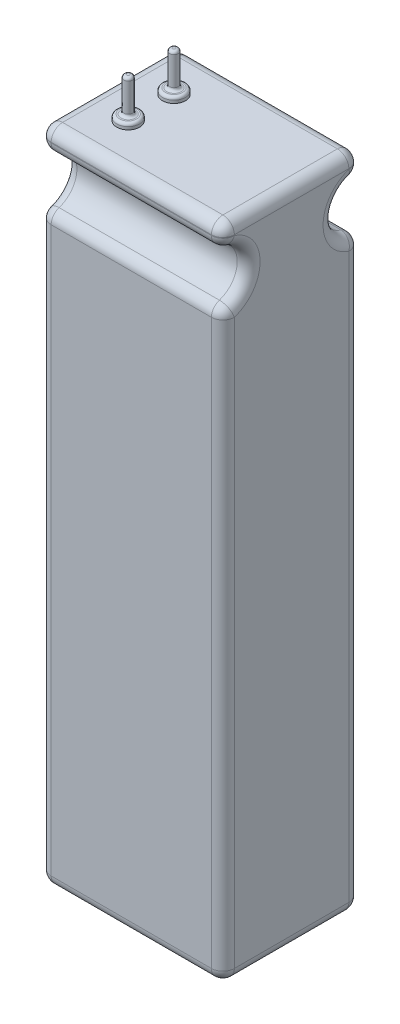
from build123d import *

# Parameters (mm, degrees)
SKETCH1_W           = 32
SKETCH1_H           = 24
BOSS_EXTRUDE1_DEPTH = 115
SKETCH2_R           = 4.5
CUT_EXTRUDE1_DEPTH  = 40
FILLET1_R           = 2
FILLET2_R           = 2
FILLET3_R           = 2
FILLET4_R           = 2
FILLET5_R           = 2
FILLET6_R           = 2
SKETCH3_R           = 2
BOSS_EXTRUDE2_DEPTH = 1
SKETCH4_R           = 0.75
BOSS_EXTRUDE3_DEPTH = 7
FILLET7_R           = 0.5
FILLET8_R           = 0.5


with BuildPart() as part:
    # Sketch1 → Boss-Extrude1 (new body)
    with BuildSketch(Plane(origin=(0, 0, 0), x_dir=(1, 0, 0), z_dir=(0, 1, 0))):
        Rectangle(SKETCH1_W, SKETCH1_H)
    extrude(amount=BOSS_EXTRUDE1_DEPTH)

    # Sketch2 → Cut-Extrude1 (cut)
    with BuildSketch(Plane.ZY.offset(16)):
        with Locations((12, 106.696833766)):
            Circle(SKETCH2_R)
        with Locations((-12, 106.696833766)):
            Circle(SKETCH2_R)
    extrude(amount=-CUT_EXTRUDE1_DEPTH, mode=Mode.SUBTRACT)

    # Fillet1
    fillet1_edges = [part.edges().sort_by_distance(p)[0] for p in [
        (0, 111.196833766, 12),
        (0, 102.196833766, 12),
    ]]
    fillet(fillet1_edges, radius=FILLET1_R)

    # Fillet2
    fillet2_edges = [part.edges().sort_by_distance(p)[0] for p in [
        (-16, 106.696833766, 7.5),
        (-16, 50.256087664, 12),
        (-16, 101.688872139, 11.61721508),
        (-16, 111.704795394, 11.61721508),
        (-16, 113.940746102, 12),
    ]]
    fillet(fillet2_edges, radius=FILLET2_R)

    # Fillet3
    fillet3_edges = [part.edges().sort_by_distance(p)[0] for p in [
        (-16, 51.098416883, -12),
        (-16, 106.696833766, -7.5),
        (0, 111.196833766, -12),
        (0, 102.196833766, -12),
        (-16, 113.098416883, -12),
    ]]
    fillet(fillet3_edges, radius=FILLET3_R)

    # Fillet4
    fillet4_edges = [part.edges().sort_by_distance(p)[0] for p in [
        (16, 106.696833766, 7.5),
        (16, 50.256087664, 12),
        (16, 101.688872139, 11.61721508),
        (16, 111.704795394, 11.61721508),
        (16, 106.696833766, -7.5),
        (16, 50.256087664, -12),
        (16, 101.688872139, -11.61721508),
        (16, 111.704795394, -11.61721508),
        (16, 113.940746102, 12),
        (16, 113.940746102, -12),
    ]]
    fillet(fillet4_edges, radius=FILLET4_R)

    # Fillet5
    fillet5_edges = [part.edges().sort_by_distance(p)[0] for p in [
        (0, 0, 12),
        (-15.414213562, 0, 11.414213562),
        (-16, 0, 0),
        (-15.414213562, 0, -11.414213562),
        (0, 0, -12),
        (16, 0, 0),
        (15.414213562, 0, 11.414213562),
        (15.414213562, 0, -11.414213562),
    ]]
    fillet(fillet5_edges, radius=FILLET5_R)

    # Fillet6
    fillet6_edges = [part.edges().sort_by_distance(p)[0] for p in [
        (0, 115, 12),
        (-15.414213562, 115, 11.414213562),
        (-16, 115, 0),
        (-15.414213562, 115, -11.414213562),
        (16, 115, 0),
        (0, 115, -12),
        (15.414213562, 115, 11.414213562),
        (15.414213562, 115, -11.414213562),
    ]]
    fillet(fillet6_edges, radius=FILLET6_R)

    # Sketch3 → Boss-Extrude2 (add)
    with BuildSketch(Plane(origin=(0, 115, 0), x_dir=(1, 0, 0), z_dir=(0, 1, 0))):
        with Locations(Location((-8.5416641, -4, 0), (0, 0, 90))):
            Circle(SKETCH3_R)
        with Locations(Location((-8.5416641, 4, 0), (0, 0, 90))):
            Circle(SKETCH3_R)
    extrude(amount=BOSS_EXTRUDE2_DEPTH)

    # Sketch4 → Boss-Extrude3 (add)
    with BuildSketch(Plane(origin=(0, 115, 0), x_dir=(1, 0, 0), z_dir=(0, 1, 0))):
        with Locations(Location((-8.5416641, -4, 0), (0, 0, 270))):
            Circle(SKETCH4_R)
        with Locations(Location((-8.5416641, 4, 0), (0, 0, 270))):
            Circle(SKETCH4_R)
    extrude(amount=BOSS_EXTRUDE3_DEPTH)

    # Fillet7
    fillet7_edges = [part.edges().sort_by_distance(p)[0] for p in [
        (-8.5416641, 116, 6),
        (-8.5416641, 116, -2),
    ]]
    fillet(fillet7_edges, radius=FILLET7_R)

    # Fillet8
    fillet8_edges = [part.edges().sort_by_distance(p)[0] for p in [
        (-8.5416641, 116, 3.25),
        (-8.5416641, 122, 3.25),
        (-8.5416641, 116, -4.75),
        (-8.5416641, 122, -4.75),
    ]]
    fillet(fillet8_edges, radius=FILLET8_R)


solid = part.part
